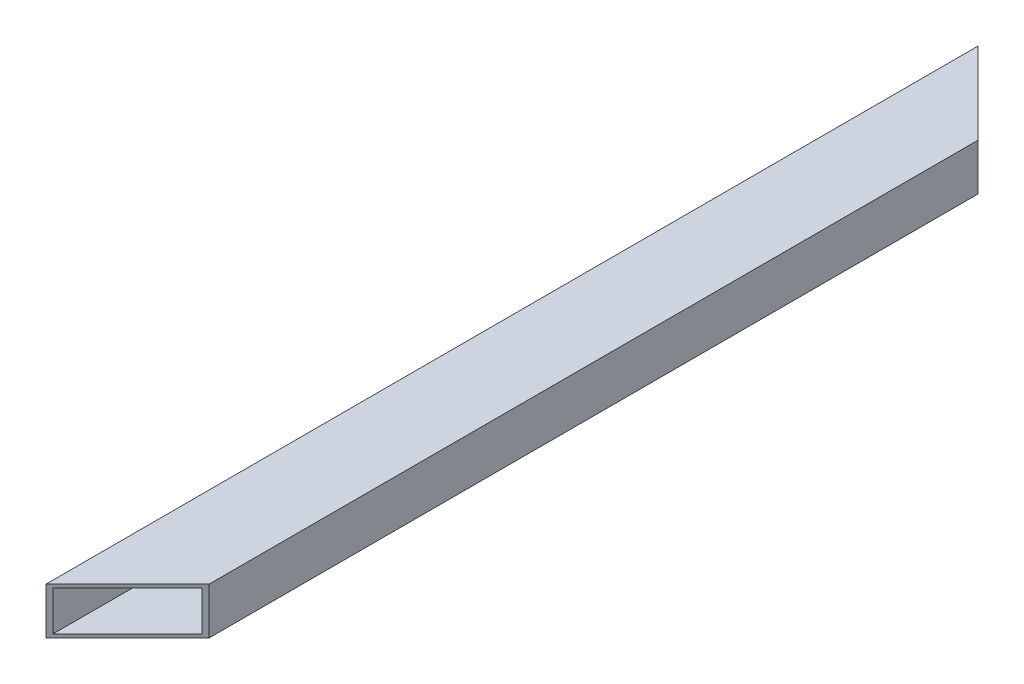
from build123d import *

# Parameters (mm, degrees)
ESQUISSE1_W             = 35
ESQUISSE1_H             = 20
ESQUISSE1_W_2           = 32
ESQUISSE1_H_2           = 17
BOSS_EXTRU_1_DEPTH      = 400
ENL_V_MAT_EXTRU_1_DEPTH = 403.026118555
ENL_V_MAT_EXTRU_3_DEPTH = 403.026118555


with BuildPart() as part:
    # Esquisse1 → Boss.-Extru.1 (new body)
    with BuildSketch(Plane.XY):
        with Locations((17.5, 10)):
            Rectangle(ESQUISSE1_W, ESQUISSE1_H)
        with Locations((17.5, 10)):
            Rectangle(ESQUISSE1_W_2, ESQUISSE1_H_2, mode=Mode.SUBTRACT)
    extrude(amount=BOSS_EXTRU_1_DEPTH)

    # Esquisse2 → Enlèv. mat.-Extru.1 (cut, through all)
    with BuildSketch(Plane(origin=(0, 0, 0), x_dir=(1, 0, 0), z_dir=(0, 1, 0))):
        Polygon((0, -400), (35, -365), (35, -400), align=None)
    extrude(amount=ENL_V_MAT_EXTRU_1_DEPTH, mode=Mode.SUBTRACT)

    # Esquisse4 → Enlèv. mat.-Extru.3 (cut, through all)
    with BuildSketch(Plane(origin=(0, 0, 0), x_dir=(1, 0, 0), z_dir=(0, 1, 0))):
        Polygon((0, 0), (35, -35), (35, 0), align=None)
    extrude(amount=ENL_V_MAT_EXTRU_3_DEPTH, mode=Mode.SUBTRACT)


solid = part.part
